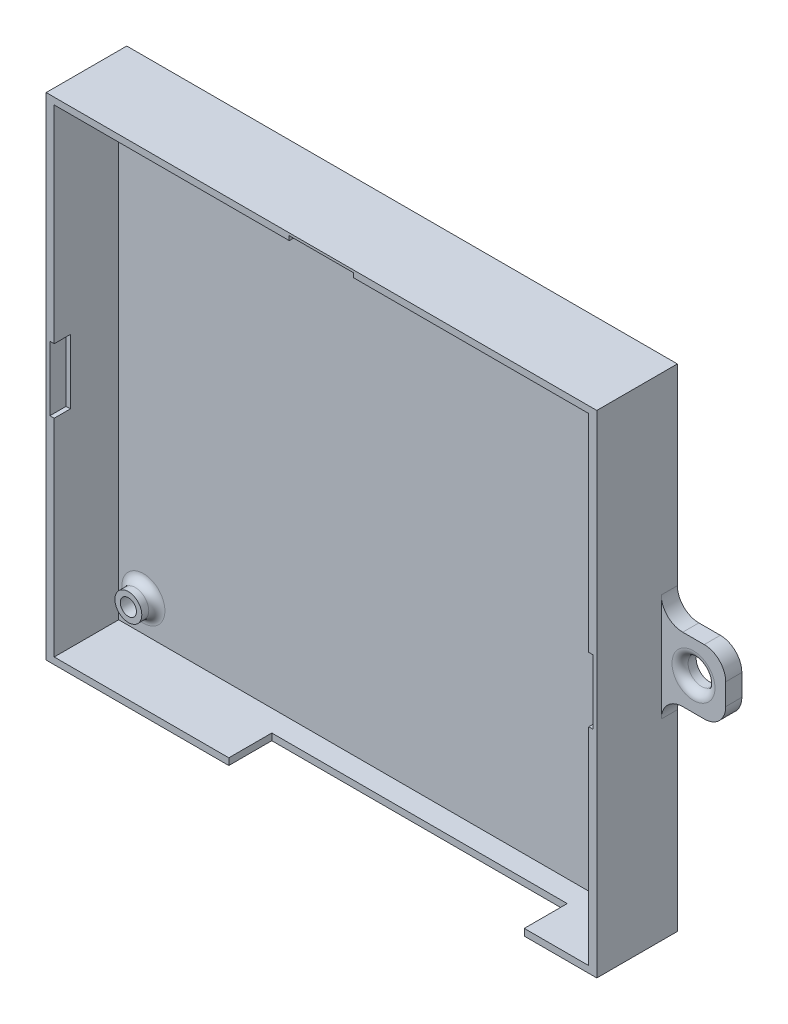
from build123d import *

# Parameters (mm, degrees)
SKETCH_1_W          = 102.5
SKETCH_1_H          = 91.5
EXTRUDE_1_DEPTH     = 15
SKETCH_2_W          = 99.5
SKETCH_2_H          = 89
CUT_EXTRUDE_1_DEPTH = 12
SKETCH_3_W          = 55
SKETCH_3_H          = 1.25
CUT_EXTRUDE_2_DEPTH = 8
SKETCH_8_R          = 1.5
EXTRUDE_2_DEPTH     = 0.1
SKETCH_9_R          = 2.5
EXTRUDE_3_DEPTH     = 2.8
SKETCH_10_W         = 0.8
SKETCH_10_H         = 12
SKETCH_10_W_2       = 12
SKETCH_10_H_2       = 0.8
CUT_EXTRUDE_3_DEPTH = 3
SKETCH_12_R         = 1.51
CUT_EXTRUDE_4_DEPTH = 10
SKETCH_14_W         = 12
SKETCH_14_H         = 12
EXTRUDE_4_DEPTH     = 3
FILLET_4_R          = 4
SKETCH_15_R         = 2.5
CUT_EXTRUDE_5_DEPTH = 3
FILLET_5_R          = 1.5
CUT_EXTRUDE_6_DEPTH = 2
FILLET_6_R          = 1.5
FILLET_7_R          = 0.5


with BuildPart() as part:
    # Эскиз1 → Бобышка-Вытянуть1 (new body)
    with BuildSketch(Plane.XY):
        Rectangle(SKETCH_1_W, SKETCH_1_H)
    extrude(amount=EXTRUDE_1_DEPTH)

    # Эскиз2 → Вырез-Вытянуть1 (cut)
    with BuildSketch(Plane.XY.offset(15)):
        Rectangle(SKETCH_2_W, SKETCH_2_H)
    extrude(amount=-CUT_EXTRUDE_1_DEPTH, mode=Mode.SUBTRACT)

    # Эскиз3 → Вырез-Вытянуть2 (cut)
    with BuildSketch(Plane.XY.offset(15)):
        with Locations((10.25, -45.125)):
            Rectangle(SKETCH_3_W, SKETCH_3_H)
    extrude(amount=-CUT_EXTRUDE_2_DEPTH, mode=Mode.SUBTRACT)

    # Эскиз8 → Бобышка-Вытянуть2 (add)
    with BuildSketch(Plane.XY.offset(3)):
        with Locations((-45.15, 39.5)):
            Circle(SKETCH_8_R)
        with Locations((44.75, 39.5)):
            Circle(SKETCH_8_R)
        with Locations((-45.15, -38.75)):
            Circle(SKETCH_8_R)
        with Locations((45.35, -39.9)):
            Circle(SKETCH_8_R)
    extrude(amount=EXTRUDE_2_DEPTH)

    # Эскиз9 → Бобышка-Вытянуть3 (add)
    with BuildSketch(Plane.XY.offset(3)):
        with Locations((-45.15, 39.5)):
            Circle(SKETCH_9_R)
        with Locations((44.75, 39.5)):
            Circle(SKETCH_9_R)
        with Locations((-45.15, -38.75)):
            Circle(SKETCH_9_R)
        with Locations((45.35, -39.9)):
            Circle(SKETCH_9_R)
    extrude(amount=EXTRUDE_3_DEPTH)

    # Эскиз10 → Вырез-Вытянуть3 (cut)
    with BuildSketch(Plane.XY.offset(15)):
        with Locations((-50.15, 0)):
            Rectangle(SKETCH_10_W, SKETCH_10_H)
        with Locations((0, 44.9)):
            Rectangle(SKETCH_10_W_2, SKETCH_10_H_2)
        with Locations((50.15, 0)):
            Rectangle(SKETCH_10_W, SKETCH_10_H)
    extrude(amount=-CUT_EXTRUDE_3_DEPTH, mode=Mode.SUBTRACT)

    # Эскиз12 → Вырез-Вытянуть4 (cut)
    with BuildSketch(Plane.XY.offset(5.8)):
        with Locations((-45.15, 39.5)):
            Circle(SKETCH_12_R)
        with Locations((44.75, 39.5)):
            Circle(SKETCH_12_R)
        with Locations((-45.15, -38.75)):
            Circle(SKETCH_12_R)
        with Locations((45.35, -39.9)):
            Circle(SKETCH_12_R)
    extrude(amount=-CUT_EXTRUDE_4_DEPTH, mode=Mode.SUBTRACT)

    # Эскиз14 → Бобышка-Вытянуть4 (add)
    with BuildSketch(Plane(origin=(0, 0, 0), x_dir=(-1, 0, 0), z_dir=(0, 0, -1))):
        with Locations((-57.25, 0)):
            Rectangle(SKETCH_14_W, SKETCH_14_H)
        with Locations((57.25, 0)):
            Rectangle(SKETCH_14_W, SKETCH_14_H)
    extrude(amount=-EXTRUDE_4_DEPTH)

    # Скругление4
    fillet_4_edges = [part.edges().sort_by_distance(p)[0] for p in [
        (51.25, 6, 1.5),
        (51.25, -6, 1.5),
        (63.25, -6, 1.5),
        (63.25, 6, 1.5),
        (-51.25, -6, 1.5),
        (-51.25, 6, 1.5),
        (-63.25, 6, 1.5),
        (-63.25, -6, 1.5),
    ]]
    fillet(fillet_4_edges, radius=FILLET_4_R)

    # Эскиз15 → Вырез-Вытянуть5 (cut)
    with BuildSketch(Plane.XY.offset(3)):
        with Locations((-57.25, 0)):
            Circle(SKETCH_15_R)
        with Locations((57.25, 0)):
            Circle(SKETCH_15_R)
    extrude(amount=-CUT_EXTRUDE_5_DEPTH, mode=Mode.SUBTRACT)

    # Скругление5
    fillet_5_edges = [part.edges().sort_by_distance(p)[0] for p in [
        (-59.75, 0, 3),
        (54.75, 0, 3),
    ]]
    fillet(fillet_5_edges, radius=FILLET_5_R)

    # Эскиз13 → Вырез-Вытянуть6 (cut)
    with BuildSketch(Plane(origin=(0, 0, 0), x_dir=(-1, 0, 0), z_dir=(0, 0, -1))):
        Polygon((-41.850244118, 38.070052743), (-42.061751409, 41.296288631), (-44.961507291, 42.726235887), (-47.649755882, 40.929947257), (-47.438248591, 37.703711369), (-44.538492709, 36.273764113), align=None)
        Polygon((-42.238678645, -40.779211442), (-43.032919879, -37.645122388), (-46.144241234, -36.765910946), (-48.461321355, -39.020788558), (-47.667080121, -42.154877612), (-44.555758766, -43.034089054), align=None)
        Polygon((47.55582544, -40.909939185), (48.223474925, -37.746463644), (45.817649485, -35.586524459), (42.74417456, -36.590060815), (42.076525075, -39.753536356), (44.482350515, -41.913475541), align=None)
        Polygon((47.888438275, 37.781195431), (48.007747558, 41.012154829), (45.269309283, 42.730959397), (42.411561725, 41.218804569), (42.292252442, 37.987845171), (45.030690717, 36.269040603), align=None)
    extrude(amount=-CUT_EXTRUDE_6_DEPTH, mode=Mode.SUBTRACT)

    # Скругление6
    fillet_6_edges = [part.edges().sort_by_distance(p)[0] for p in [
        (-47.65, 39.5, 3),
        (42.25, 39.5, 3),
        (-47.65, -38.75, 3),
        (42.85, -39.9, 3),
    ]]
    fillet(fillet_6_edges, radius=FILLET_6_R)

    # Скругление7
    fillet_7_edges = [part.edges().sort_by_distance(p)[0] for p in [
        (-46.459564496, 37.025118017, 0),
        (-47.948092917, 39.39667513, 0),
        (-46.638528421, 41.871557113, 0),
        (-43.840435504, 41.974881983, 0),
        (-42.351907083, 39.60332487, 0),
        (-43.661471579, 37.128442887, 0),
        (-46.019087978, -41.411707363, 0),
        (-47.889650183, -39.328201415, 0),
        (-47.020562205, -36.666494052, 0),
        (-44.280912022, -36.088292637, 0),
        (-42.410349817, -38.171798585, 0),
        (-43.279437795, -40.833505948, 0),
        (43.397218706, -41.906650248, 0),
        (42.635799262, -39.212166915, 0),
        (44.588580556, -37.205516667, 0),
        (47.302781294, -37.893349752, 0),
        (48.064200738, -40.587833085, 0),
        (46.111419444, -42.594483333, 0),
        (43.194368413, 37.171908428, 0),
        (41.955997763, 39.683170687, 0),
        (43.51162935, 42.011262259, 0),
        (46.305631587, 41.828091572, 0),
        (47.544002237, 39.316829313, 0),
        (45.98837065, 36.988737741, 0),
    ]]
    fillet(fillet_7_edges, radius=FILLET_7_R)


solid = part.part
